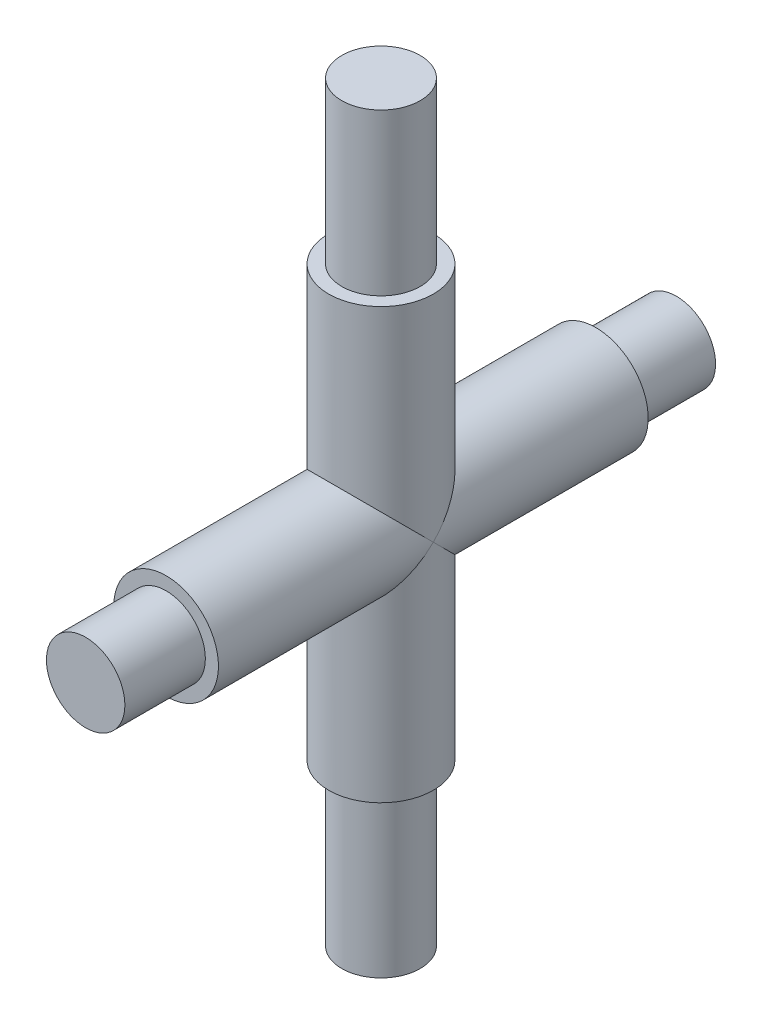
from build123d import *

# Parameters (mm, degrees)
SKETCH1_R                = 6.5
BOSS_EXTRUDE1_DEPTH      = 53.4
SKETCH11_R               = 4.875
BOSS_EXTRUDE2_DEPTH      = 20
BOSS_EXTRUDE3_START      = 20
SKETCH12_R               = 4.875
BOSS_EXTRUDE3_DEPTH      = 20
CIRPATTERN1_COUNT        = 2
BOSS_EXTRUDE4_DEPTH      = 26.7
BOSS_EXTRUDE4_DEPTH_BACK = 26.7
SKETCH13_R               = 6.5
SKETCH14_R               = 4.875
BOSS_EXTRUDE5_DEPTH      = 10
BOSS_EXTRUDE6_START      = 10
SKETCH15_R               = 4.875
BOSS_EXTRUDE6_DEPTH      = 10


with BuildPart() as part:
    # Sketch1 → Boss-Extrude1 (new body)
    with BuildSketch(Plane(origin=(0, 0, 0), x_dir=(1, 0, 0), z_dir=(0, 1, 0))):
        Circle(SKETCH1_R)
    boss_extrude1 = extrude(amount=BOSS_EXTRUDE1_DEPTH)

    # Sketch11 → Boss-Extrude2 (add)
    with BuildSketch(Plane(origin=(0, 0, 0), x_dir=(-1, 0, 0), z_dir=(0, -1, 0))):
        Circle(SKETCH11_R)
    boss_extrude2 = extrude(amount=BOSS_EXTRUDE2_DEPTH)

    # Sketch12 → Boss-Extrude3 (add)
    with BuildSketch(Plane(origin=(0, 53.4, 0), x_dir=(1, 0, 0), z_dir=(0, 1, 0)).offset(BOSS_EXTRUDE3_START)):
        Circle(SKETCH12_R)
    boss_extrude3 = extrude(amount=-BOSS_EXTRUDE3_DEPTH)

    # CirPattern1: Boss-Extrude1, Boss-Extrude2, Boss-Extrude3 ×2 about axis
    cirpattern1_axis = Axis((0, 26.7, 0), (1, 0, 0))
    add([boss_extrude1.rotate(cirpattern1_axis, i * 360 / CIRPATTERN1_COUNT) for i in range(1, CIRPATTERN1_COUNT)])
    add([boss_extrude2.rotate(cirpattern1_axis, i * 360 / CIRPATTERN1_COUNT) for i in range(1, CIRPATTERN1_COUNT)])
    add([boss_extrude3.rotate(cirpattern1_axis, i * 360 / CIRPATTERN1_COUNT) for i in range(1, CIRPATTERN1_COUNT)])

    # Sketch13 → Boss-Extrude4 (add, two sides: drawn at the far end of the back side and taken through both)
    with BuildSketch(Plane(origin=(0, 0, 0), x_dir=(-1, 0, 0), z_dir=(0, 0, -1)).offset(-BOSS_EXTRUDE4_DEPTH_BACK)):
        with Locations((0, 26.7)):
            Circle(SKETCH13_R)
    extrude(amount=BOSS_EXTRUDE4_DEPTH + BOSS_EXTRUDE4_DEPTH_BACK)

    # Sketch14 → Boss-Extrude5 (add)
    with BuildSketch(Plane(origin=(0, 0, -26.7), x_dir=(-1, 0, 0), z_dir=(0, 0, -1))):
        with Locations((0, 26.7)):
            Circle(SKETCH14_R)
    extrude(amount=BOSS_EXTRUDE5_DEPTH)

    # Sketch15 → Boss-Extrude6 (add)
    with BuildSketch(Plane.XY.offset(26.7).offset(BOSS_EXTRUDE6_START)):
        with Locations((0, 26.7)):
            Circle(SKETCH15_R)
    extrude(amount=-BOSS_EXTRUDE6_DEPTH)


solid = part.part
